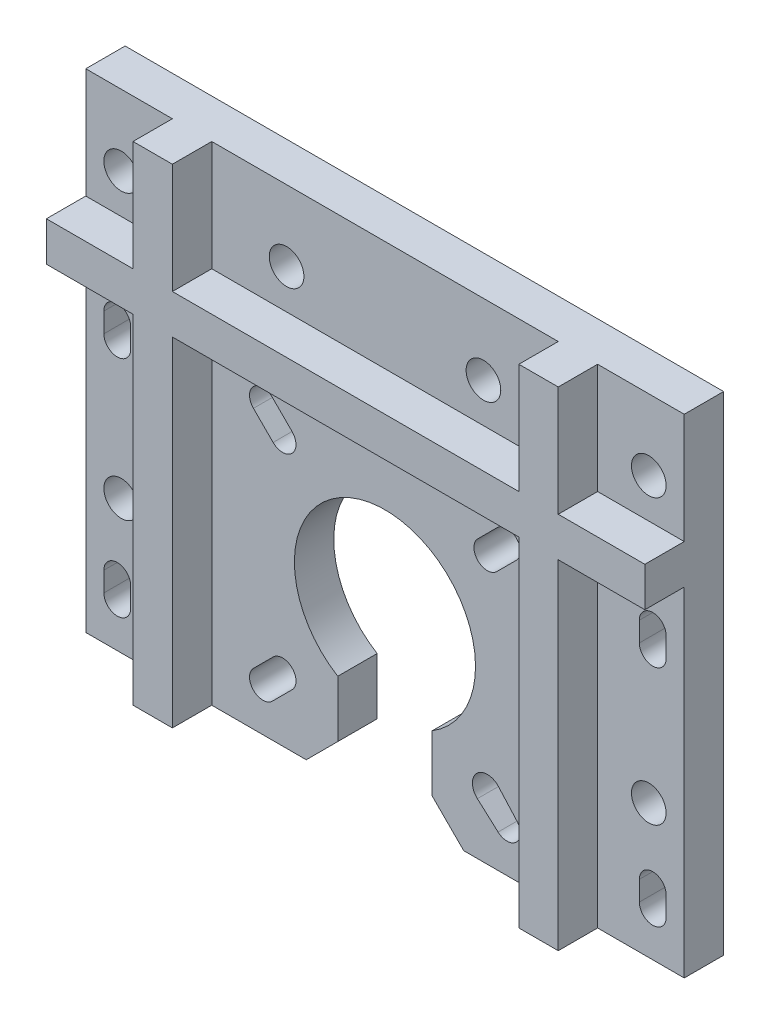
from build123d import *

# Parameters (mm, degrees)
SKETCH1_W           = 76
SKETCH1_H           = 62
BOSS_EXTRUDE1_DEPTH = 10
SKETCH2_W           = 44
SKETCH2_H           = 5
CUT_EXTRUDE1_DEPTH  = 43
CUT_EXTRUDE2_DEPTH  = 73.890328577
CUT_EXTRUDE3_DEPTH  = 73.890328577
CUT_EXTRUDE4_DEPTH  = 73.890328577
CUT_EXTRUDE5_DEPTH  = 73.890328577
CUT_EXTRUDE6_DEPTH  = 74.402997214
SKETCH8_W           = 11
SKETCH8_H           = 5
CUT_EXTRUDE7_DEPTH  = 43
CUT_EXTRUDE8_DEPTH  = 74.402997214
SKETCH10_W          = 11
SKETCH10_H          = 5
CUT_EXTRUDE9_DEPTH  = 43
CUT_EXTRUDE10_DEPTH = 73.890328577
CUT_EXTRUDE11_DEPTH = 74.402997214
CUT_EXTRUDE12_DEPTH = 73.890328577
SKETCH14_W          = 11
SKETCH14_H          = 5
CUT_EXTRUDE13_DEPTH = 14
SKETCH15_W          = 11
SKETCH15_H          = 5
CUT_EXTRUDE14_DEPTH = 14
SKETCH16_W          = 44
SKETCH16_H          = 5
CUT_EXTRUDE15_DEPTH = 14
SKETCH17_W          = 11.5
SKETCH17_H          = 5
HOLE1_D             = 4.4
HOLE2_D             = 4.4
HOLE3_D             = 4.4
HOLE4_D             = 4.4
HOLE5_D             = 4.4
HOLE6_D             = 4.4
CHAMFER1_SIZE       = 4
CHAMFER2_SIZE       = 4


with BuildPart() as part:
    # Sketch1 → Boss-Extrude1 (new body)
    with BuildSketch(Plane(origin=(0, 0, 0), x_dir=(-1, 0, 0), z_dir=(0, 0, -1))):
        with Locations((0, 31)):
            Rectangle(SKETCH1_W, SKETCH1_H)
    extrude(amount=-BOSS_EXTRUDE1_DEPTH)

    # Sketch2 → Cut-Extrude1 (cut)
    with BuildSketch(Plane.XZ):
        with Locations((0, 7.5)):
            Rectangle(SKETCH2_W, SKETCH2_H)
    extrude(amount=-CUT_EXTRUDE1_DEPTH, mode=Mode.SUBTRACT)

    # Sketch3 → Cut-Extrude2 (cut, through all)
    with BuildSketch(Plane.XY.offset(5)):
        with BuildLine():
            Line((-6, 0), (6, 0))
            Line((6, 0), (6, 11.192803568))
            ThreePointArc((6, 11.192803568), (0.00098815, 9.500001967), (-6, 11.185784174))
            Line((-6, 11.185784174), (-6, 0))
        make_face()
    extrude(amount=-CUT_EXTRUDE2_DEPTH, mode=Mode.SUBTRACT)

    # Sketch4 → Cut-Extrude3 (cut, through all)
    with BuildSketch(Plane.XY.offset(5)):
        with BuildLine():
            Line((-11.803657239, 35.202081528), (-14.303657239, 37.702081528))
            ThreePointArc((-14.303657239, 37.702081528), (-16.707820295, 37.702081528), (-16.707820295, 35.297918472))
            Line((-16.707820295, 35.297918472), (-14.207820295, 32.797918472))
            ThreePointArc((-14.207820295, 32.797918472), (-11.803657239, 32.797918472), (-11.803657239, 35.202081528))
        make_face()
    extrude(amount=-CUT_EXTRUDE3_DEPTH, mode=Mode.SUBTRACT)

    # Sketch5 → Cut-Extrude4 (cut, through all)
    with BuildSketch(Plane.XY.offset(5)):
        with BuildLine():
            Line((-14.207820295, 9.202081528), (-16.707820295, 6.702081528))
            ThreePointArc((-16.707820295, 6.702081528), (-16.707820295, 4.297918472), (-14.303657239, 4.297918472))
            Line((-14.303657239, 4.297918472), (-11.803657239, 6.797918472))
            ThreePointArc((-11.803657239, 6.797918472), (-11.803657239, 9.202081528), (-14.207820295, 9.202081528))
        make_face()
    extrude(amount=-CUT_EXTRUDE4_DEPTH, mode=Mode.SUBTRACT)

    # Sketch6 → Cut-Extrude5 (cut, through all)
    with BuildSketch(Plane.XY.offset(5)):
        with BuildLine():
            Line((11.730546448, 6.589437375), (14.359896375, 4.233818192))
            ThreePointArc((14.359896375, 4.233818192), (16.696342761, 4.297918472), (16.760443041, 6.634364857))
            Line((16.760443041, 6.634364857), (14.404823858, 9.263714785))
            ThreePointArc((14.404823858, 9.263714785), (11.655108147, 9.339153086), (11.730546448, 6.589437375))
        make_face()
    extrude(amount=-CUT_EXTRUDE5_DEPTH, mode=Mode.SUBTRACT)

    # Sketch7 → Cut-Extrude6 (cut, through all)
    with BuildSketch(Plane(origin=(0, 0, 0), x_dir=(-1, 0, 0), z_dir=(0, 0, -1))):
        with BuildLine():
            Line((-16.696342761, 35.297918472), (-14.196342761, 32.797918472))
            ThreePointArc((-14.196342761, 32.797918472), (-11.792179705, 32.797918472), (-11.792179705, 35.202081528))
            Line((-11.792179705, 35.202081528), (-14.292179705, 37.702081528))
            ThreePointArc((-14.292179705, 37.702081528), (-16.696342761, 37.702081528), (-16.696342761, 35.297918472))
        make_face()
    extrude(amount=-CUT_EXTRUDE6_DEPTH, mode=Mode.SUBTRACT)

    # Sketch8 → Cut-Extrude7 (cut)
    with BuildSketch(Plane.XZ):
        with Locations((32.5, 7.5)):
            Rectangle(SKETCH8_W, SKETCH8_H)
    extrude(amount=-CUT_EXTRUDE7_DEPTH, mode=Mode.SUBTRACT)

    # Sketch9 → Cut-Extrude8 (cut, through all)
    with BuildSketch(Plane(origin=(0, 0, 0), x_dir=(-1, 0, 0), z_dir=(0, 0, -1))):
        with BuildLine():
            Line((-32.3, 34), (-32.3, 36.5))
            ThreePointArc((-32.3, 36.5), (-34, 38.2), (-35.7, 36.5))
            Line((-35.7, 36.5), (-35.7, 34))
            ThreePointArc((-35.7, 34), (-34, 32.3), (-32.3, 34))
        make_face()
    extrude(amount=-CUT_EXTRUDE8_DEPTH, mode=Mode.SUBTRACT)

    # Sketch10 → Cut-Extrude9 (cut)
    with BuildSketch(Plane.XZ):
        with Locations((-32.5, 7.5)):
            Rectangle(SKETCH10_W, SKETCH10_H)
    extrude(amount=-CUT_EXTRUDE9_DEPTH, mode=Mode.SUBTRACT)

    # Sketch11 → Cut-Extrude10 (cut, through all)
    with BuildSketch(Plane.XY.offset(5)):
        with BuildLine():
            Line((-35.7, 36.5), (-35.7, 34))
            ThreePointArc((-35.7, 34), (-34, 32.3), (-32.3, 34))
            Line((-32.3, 34), (-32.3, 36.5))
            ThreePointArc((-32.3, 36.5), (-34, 38.2), (-35.7, 36.5))
        make_face()
    extrude(amount=-CUT_EXTRUDE10_DEPTH, mode=Mode.SUBTRACT)

    # Sketch12 → Cut-Extrude11 (cut, through all)
    with BuildSketch(Plane(origin=(0, 0, 0), x_dir=(-1, 0, 0), z_dir=(0, 0, -1))):
        with BuildLine():
            Line((32.3, 8), (32.3, 5.5))
            ThreePointArc((32.3, 5.5), (34, 3.8), (35.7, 5.5))
            Line((35.7, 5.5), (35.7, 8))
            ThreePointArc((35.7, 8), (34, 9.7), (32.3, 8))
        make_face()
    extrude(amount=-CUT_EXTRUDE11_DEPTH, mode=Mode.SUBTRACT)

    # Sketch13 → Cut-Extrude12 (cut, through all)
    with BuildSketch(Plane.XY.offset(5)):
        with BuildLine():
            Line((35.7, 5.5), (35.7, 8))
            ThreePointArc((35.7, 8), (34, 9.7), (32.3, 8))
            Line((32.3, 8), (32.3, 5.5))
            ThreePointArc((32.3, 5.5), (34, 3.8), (35.7, 5.5))
        make_face()
    extrude(amount=-CUT_EXTRUDE12_DEPTH, mode=Mode.SUBTRACT)

    # Sketch14 → Cut-Extrude13 (cut)
    with BuildSketch(Plane(origin=(0, 62, 0), x_dir=(-1, 0, 0), z_dir=(0, 1, 0))):
        with Locations((-32.5, 7.5)):
            Rectangle(SKETCH14_W, SKETCH14_H)
    extrude(amount=-CUT_EXTRUDE13_DEPTH, mode=Mode.SUBTRACT)

    # Sketch15 → Cut-Extrude14 (cut)
    with BuildSketch(Plane(origin=(0, 62, 0), x_dir=(-1, 0, 0), z_dir=(0, 1, 0))):
        with Locations((32.5, 7.5)):
            Rectangle(SKETCH15_W, SKETCH15_H)
    extrude(amount=-CUT_EXTRUDE14_DEPTH, mode=Mode.SUBTRACT)

    # Sketch16 → Cut-Extrude15 (cut)
    with BuildSketch(Plane(origin=(0, 62, 0), x_dir=(-1, 0, 0), z_dir=(0, 1, 0))):
        with Locations((0, 7.5)):
            Rectangle(SKETCH16_W, SKETCH16_H)
    extrude(amount=-CUT_EXTRUDE15_DEPTH, mode=Mode.SUBTRACT)

    # Sketch17 → Cut-Revolve1 (revolve, cut)
    with BuildSketch(Plane(origin=(0, 21, 0), x_dir=(-1, 0, 0), z_dir=(0, 1, 0))):
        with Locations((-5.744261233, 2.5)):
            Rectangle(SKETCH17_W, SKETCH17_H)
    revolve(axis=Axis((-0.005738767, 21, 0), (0, 0, 1)), mode=Mode.SUBTRACT)

    # Hole1 (through all)
    with Locations(Plane.XY.offset(5)):
        with Locations((-33.5, 17)):
            Hole(HOLE1_D / 2)

    # Hole2 (through all)
    with Locations(Plane.XY.offset(5)):
        with Locations((33.5, 17)):
            Hole(HOLE2_D / 2)

    # Hole3 (through all)
    with Locations(Plane.XY.offset(5)):
        with Locations((33.5, 53)):
            Hole(HOLE3_D / 2)

    # Hole4 (through all)
    with Locations(Plane.XY.offset(5)):
        with Locations((-33.5, 53)):
            Hole(HOLE4_D / 2)

    # Hole5 (through all)
    with Locations(Plane.XY.offset(5)):
        with Locations((-12.5, 53)):
            Hole(HOLE5_D / 2)

    # Hole6 (through all)
    with Locations(Plane.XY.offset(5)):
        with Locations((12.5, 53)):
            Hole(HOLE6_D / 2)

    # Chamfer1
    chamfer1_edges = [part.edges().sort_by_distance(p)[0] for p in [
        (-6, 0, 2.5),
    ]]
    chamfer(chamfer1_edges, length=CHAMFER1_SIZE)

    # Chamfer2
    chamfer2_edges = [part.edges().sort_by_distance(p)[0] for p in [
        (6, 0, 2.5),
    ]]
    chamfer(chamfer2_edges, length=CHAMFER2_SIZE)


solid = part.part
